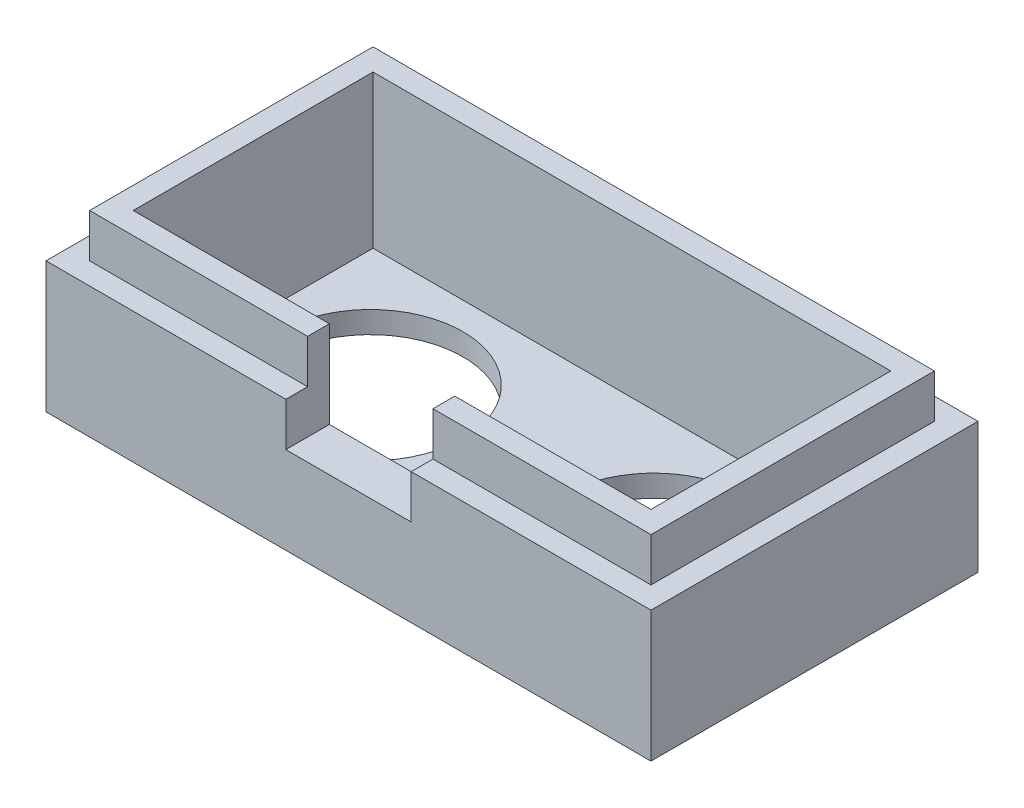
from build123d import *

# Parameters (mm, degrees)
SKETCH1_W           = 47.5
SKETCH1_H           = 22
SKETCH1_R           = 8.5
BOSS_EXTRUDE1_DEPTH = 2
SKETCH1_3_W         = 51.5
SKETCH1_3_H         = 26
SKETCH1_3_W_2       = 47.5
SKETCH1_3_H_2       = 22
BOSS_EXTRUDE2_DEPTH = 16
SKETCH1_5_W         = 55.5
SKETCH1_5_H         = 30
SKETCH1_5_W_2       = 51.5
SKETCH1_5_H_2       = 26
BOSS_EXTRUDE3_DEPTH = 12
SKETCH2_W           = 11.5
SKETCH2_H           = 8
CUT_EXTRUDE1_DEPTH  = 12


with BuildPart() as part:
    # Sketch1 → Boss-Extrude1 (new body)
    with BuildSketch(Plane(origin=(0, 0, 0), x_dir=(1, 0, 0), z_dir=(0, 1, 0))):
        Rectangle(SKETCH1_W, SKETCH1_H)
        with Locations((-13, 0)):
            Circle(SKETCH1_R, mode=Mode.SUBTRACT)
        with Locations((13, 0)):
            Circle(SKETCH1_R, mode=Mode.SUBTRACT)
    extrude(amount=BOSS_EXTRUDE1_DEPTH)

    # Sketch1<3> → Boss-Extrude2 (add)
    with BuildSketch(Plane(origin=(0, 0, 0), x_dir=(1, 0, 0), z_dir=(0, 1, 0))):
        Rectangle(SKETCH1_3_W, SKETCH1_3_H)
        Rectangle(SKETCH1_3_W_2, SKETCH1_3_H_2, mode=Mode.SUBTRACT)
    extrude(amount=BOSS_EXTRUDE2_DEPTH)

    # Sketch1<5> → Boss-Extrude3 (add)
    with BuildSketch(Plane(origin=(0, 0, 0), x_dir=(1, 0, 0), z_dir=(0, 1, 0))):
        Rectangle(SKETCH1_5_W, SKETCH1_5_H)
        Rectangle(SKETCH1_5_W_2, SKETCH1_5_H_2, mode=Mode.SUBTRACT)
    extrude(amount=BOSS_EXTRUDE3_DEPTH)

    # Sketch2 → Cut-Extrude1 (cut)
    with BuildSketch(Plane.XY.offset(15)):
        with Locations((0, 12)):
            Rectangle(SKETCH2_W, SKETCH2_H)
    extrude(amount=-CUT_EXTRUDE1_DEPTH, mode=Mode.SUBTRACT)


solid = part.part
